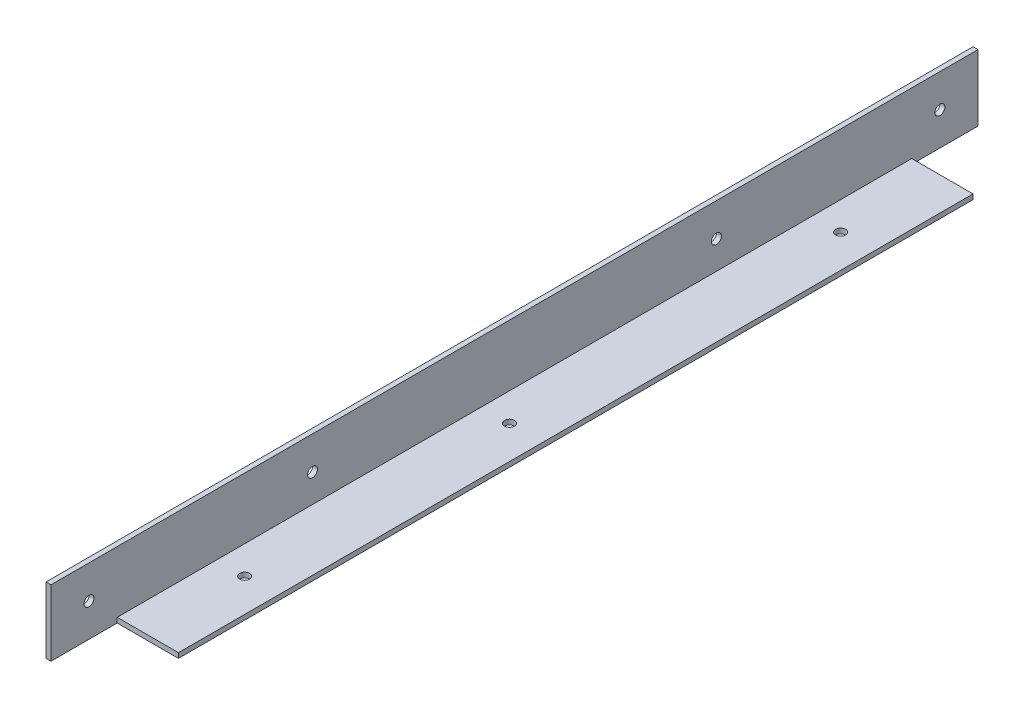
from build123d import *

# Parameters (mm, degrees)
EXTRUSION1_DEPTH = 240
ESQUISSE2_R      = 1.5
EXTRUSION2_DEPTH = 242.541404318
ESQUISSE3_W      = 1.5
ESQUISSE3_H      = 20
EXTRUSION3_DEPTH = 20
ESQUISSE5_W      = 1.5
ESQUISSE5_H      = 20
EXTRUSION4_DEPTH = 20
ESQUISSE6_R      = 1.5
EXTRUSION5_DEPTH = 262.423506977


with BuildPart() as part:
    # Esquisse1 → Extrusion1 (new body)
    with BuildSketch(Plane.XY):
        Polygon((0, 0), (20, 0), (20, 1.5), (1.5, 1.5), (1.5, 20), (0, 20), align=None)
    extrude(amount=EXTRUSION1_DEPTH)

    # Esquisse2 → Extrusion2 (cut, through all)
    with BuildSketch(Plane(origin=(0, 1.5, 0), x_dir=(1, 0, 0), z_dir=(0, 1, 0))):
        with Locations(Location((10, -30, 0), (0, 0, 180))):
            Circle(ESQUISSE2_R)
        with Locations(Location((10, -210, 0), (0, 0, 180))):
            Circle(ESQUISSE2_R)
        with Locations(Location((10, -130, 0), (0, 0, 180))):
            Circle(ESQUISSE2_R)
    extrude(amount=-EXTRUSION2_DEPTH, mode=Mode.SUBTRACT)

    # Esquisse3 → Extrusion3 (add)
    with BuildSketch(Plane.XY.offset(240)):
        with Locations((0.75, 10)):
            Rectangle(ESQUISSE3_W, ESQUISSE3_H)
    extrude(amount=EXTRUSION3_DEPTH)

    # Esquisse5 → Extrusion4 (add)
    with BuildSketch(Plane(origin=(0, 0, 0), x_dir=(-1, 0, 0), z_dir=(0, 0, -1))):
        with Locations((-0.75, 10)):
            Rectangle(ESQUISSE5_W, ESQUISSE5_H)
    extrude(amount=EXTRUSION4_DEPTH)

    # Esquisse6 → Extrusion5 (cut, through all)
    with BuildSketch(Plane(origin=(1.5, 0, 0), x_dir=(0, 0, -1), z_dir=(1, 0, 0))):
        with Locations(Location((-248.5, 10, 0), (0, 0, 90))):
            Circle(ESQUISSE6_R)
        with Locations(Location((8.5, 10, 0), (0, 0, 90))):
            Circle(ESQUISSE6_R)
        with Locations(Location((-181, 10, 0), (0, 0, 90))):
            Circle(ESQUISSE6_R)
        with Locations(Location((-59, 10, 0), (0, 0, 90))):
            Circle(ESQUISSE6_R)
    extrude(amount=-EXTRUSION5_DEPTH, mode=Mode.SUBTRACT)


solid = part.part
